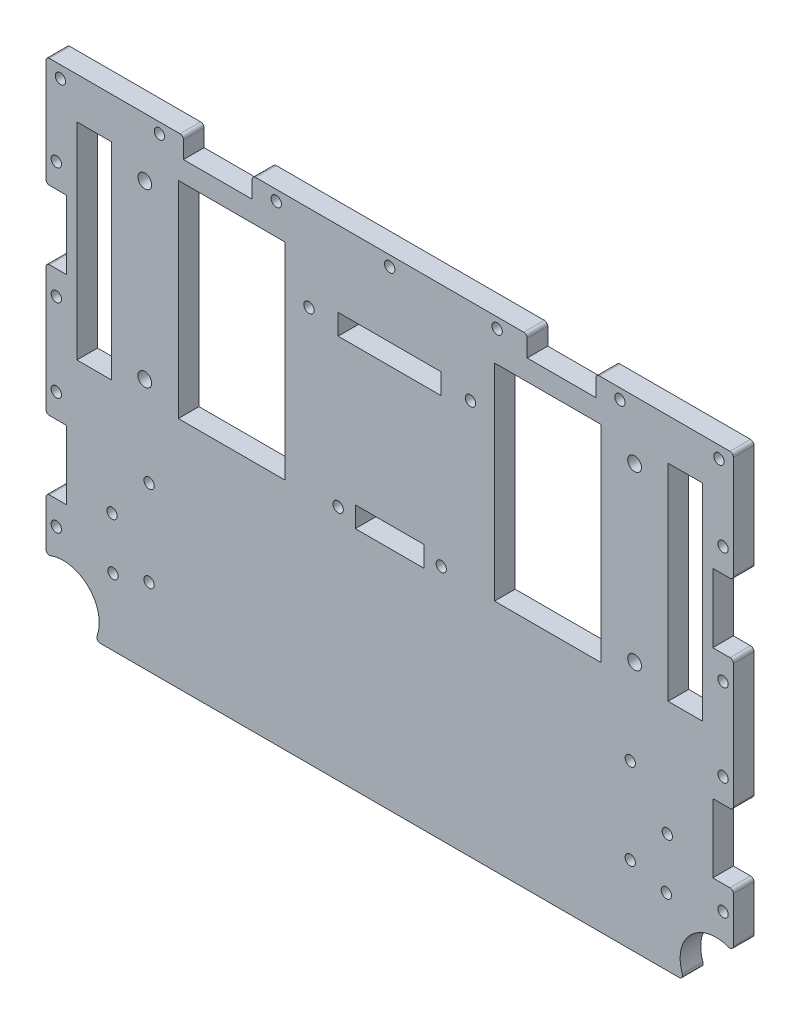
from build123d import *

# Parameters (mm, degrees)
ESQUISSE1_W              = 200
ESQUISSE1_H              = 140
BOSS_EXTRU_1_DEPTH       = 6
ESQUISSE8_W              = 31
ESQUISSE8_H              = 60
ESQUISSE8_W_2            = 10
ENL_V_MAT_EXTRU_2_DEPTH  = 6
ESQUISSE9_W              = 20
ESQUISSE9_H              = 6
ENL_V_MAT_EXTRU_3_DEPTH  = 6
ESQUISSE10_W             = 6
ESQUISSE10_H             = 20
ENL_V_MAT_EXTRU_4_DEPTH  = 6
ESQUISSE14_W             = 30
ESQUISSE14_H             = 6
ENL_V_MAT_EXTRU_7_DEPTH  = 6
ESQUISSE15_R             = 10.5
ENL_V_MAT_EXTRU_8_DEPTH  = 6
ESQUISSE19_R             = 2
ENL_V_MAT_EXTRU_11_DEPTH = 245.204832057
ESQUISSE20_R             = 1.5
ENL_V_MAT_EXTRU_12_DEPTH = 245.204832057
ESQUISSE21_R             = 1.5
ESQUISSE21_W             = 20
ESQUISSE21_H             = 6
ENL_V_MAT_EXTRU_13_DEPTH = 10
ESQUISSE23_R             = 1.5
ENL_V_MAT_EXTRU_15_DEPTH = 6
ESQUISSE16_R             = 1.5
ENL_V_MAT_EXTRU_9_DEPTH  = 6
ESQUISSE28_W             = 6
ESQUISSE28_H             = 20
ENL_V_MAT_EXTRU_17_DEPTH = 245.204832057
ESQUISSE29_R             = 1.5
ENL_V_MAT_EXTRU_18_DEPTH = 245.204832057
ESQUISSE35_R             = 1.5
ENL_V_MAT_EXTRU_21_DEPTH = 6
CONG_1_R                 = 1


with BuildPart() as part:
    # Esquisse1 → Boss.-Extru.1 (new body)
    with BuildSketch(Plane.XY):
        with Locations((100, -70)):
            Rectangle(ESQUISSE1_W, ESQUISSE1_H)
    extrude(amount=BOSS_EXTRU_1_DEPTH)

    # Esquisse8 → Enlèv. mat.-Extru.2 (cut)
    with BuildSketch(Plane(origin=(0, 0, 0), x_dir=(-1, 0, 0), z_dir=(0, 0, -1))):
        with Locations((-146, -42)):
            Rectangle(ESQUISSE8_W, ESQUISSE8_H)
        with Locations((-186, -42)):
            Rectangle(ESQUISSE8_W_2, ESQUISSE8_H)
        with Locations((-14, -42)):
            Rectangle(ESQUISSE8_W_2, ESQUISSE8_H)
        with Locations((-54, -42)):
            Rectangle(ESQUISSE8_W, ESQUISSE8_H)
    extrude(amount=-ENL_V_MAT_EXTRU_2_DEPTH, mode=Mode.SUBTRACT)

    # Esquisse9 → Enlèv. mat.-Extru.3 (cut)
    with BuildSketch(Plane(origin=(0, 0, 0), x_dir=(-1, 0, 0), z_dir=(0, 0, -1))):
        with Locations((-150, -3)):
            Rectangle(ESQUISSE9_W, ESQUISSE9_H)
        with Locations((-50, -3)):
            Rectangle(ESQUISSE9_W, ESQUISSE9_H)
    extrude(amount=-ENL_V_MAT_EXTRU_3_DEPTH, mode=Mode.SUBTRACT)

    # Esquisse10 → Enlèv. mat.-Extru.4 (cut)
    with BuildSketch(Plane(origin=(0, 0, 0), x_dir=(-1, 0, 0), z_dir=(0, 0, -1))):
        with Locations((-197, -100)):
            Rectangle(ESQUISSE10_W, ESQUISSE10_H)
        with Locations((-3, -100)):
            Rectangle(ESQUISSE10_W, ESQUISSE10_H)
    extrude(amount=-ENL_V_MAT_EXTRU_4_DEPTH, mode=Mode.SUBTRACT)

    # Esquisse14 → Enlèv. mat.-Extru.7 (cut)
    with BuildSketch(Plane.XY.offset(6)):
        with Locations((100, -25)):
            Rectangle(ESQUISSE14_W, ESQUISSE14_H)
    extrude(amount=-ENL_V_MAT_EXTRU_7_DEPTH, mode=Mode.SUBTRACT)

    # Esquisse15 → Enlèv. mat.-Extru.8 (cut)
    with BuildSketch(Plane.XY.offset(6)):
        with Locations((195, -135)):
            Circle(ESQUISSE15_R)
        with Locations((5, -135)):
            Circle(ESQUISSE15_R)
    extrude(amount=-ENL_V_MAT_EXTRU_8_DEPTH, mode=Mode.SUBTRACT)

    # Esquisse19 → Enlèv. mat.-Extru.11 (cut, through all)
    with BuildSketch(Plane(origin=(0, 0, 0), x_dir=(-1, 0, 0), z_dir=(0, 0, -1))):
        with Locations((-28.75, -67)):
            Circle(ESQUISSE19_R)
        with Locations((-28.75, -17)):
            Circle(ESQUISSE19_R)
        with Locations(Location((-171.25, -17, 0), (0, 0, 180))):
            Circle(ESQUISSE19_R)
        with Locations(Location((-171.25, -67, 0), (0, 0, 180))):
            Circle(ESQUISSE19_R)
    extrude(amount=-ENL_V_MAT_EXTRU_11_DEPTH, mode=Mode.SUBTRACT)

    # Esquisse20 → Enlèv. mat.-Extru.12 (cut, through all)
    with BuildSketch(Plane.XY.offset(6)):
        with Locations((19.495689014, -120.504310986)):
            Circle(ESQUISSE20_R)
        with Locations((19.212846302, -105.506977889)):
            Circle(ESQUISSE20_R)
        with Locations(Location((180.787153698, -105.506977889, 0), (0, 0, 180))):
            Circle(ESQUISSE20_R)
        with Locations((30, -117.5)):
            Circle(ESQUISSE20_R)
        with Locations((30, -92.5)):
            Circle(ESQUISSE20_R)
        with Locations(Location((180.504310986, -120.504310986, 0), (0, 0, 180))):
            Circle(ESQUISSE20_R)
        with Locations(Location((170, -92.5, 0), (0, 0, 180))):
            Circle(ESQUISSE20_R)
        with Locations(Location((170, -117.5, 0), (0, 0, 180))):
            Circle(ESQUISSE20_R)
        with Locations((76.5, -25)):
            Circle(ESQUISSE20_R)
        with Locations((123.5, -25)):
            Circle(ESQUISSE20_R)
    extrude(amount=-ENL_V_MAT_EXTRU_12_DEPTH, mode=Mode.SUBTRACT)

    # Esquisse21 → Enlèv. mat.-Extru.13 (cut)
    with BuildSketch(Plane(origin=(0, 0, 0), x_dir=(-1, 0, 0), z_dir=(0, 0, -1))):
        with Locations((-85, -71)):
            Circle(ESQUISSE21_R)
        with Locations((-115, -71)):
            Circle(ESQUISSE21_R)
        with Locations((-100, -71)):
            Rectangle(ESQUISSE21_W, ESQUISSE21_H)
    extrude(amount=-ENL_V_MAT_EXTRU_13_DEPTH, mode=Mode.SUBTRACT)

    # Esquisse23 → Enlèv. mat.-Extru.15 (cut)
    with BuildSketch(Plane(origin=(0, 0, 0), x_dir=(-1, 0, 0), z_dir=(0, 0, -1))):
        with Locations(Location((-4.2, -3.5, 0), (0, 0, 180))):
            Circle(ESQUISSE23_R)
        with Locations((-195.8, -3.5)):
            Circle(ESQUISSE23_R)
    extrude(amount=-ENL_V_MAT_EXTRU_15_DEPTH, mode=Mode.SUBTRACT)

    # Esquisse16 → Enlèv. mat.-Extru.9 (cut)
    with BuildSketch(Plane(origin=(0, 0, 0), x_dir=(-1, 0, 0), z_dir=(0, 0, -1))):
        with Locations((-3, -83)):
            Circle(ESQUISSE16_R)
        with Locations(Location((-197, -117, 0), (0, 0, 180))):
            Circle(ESQUISSE16_R)
        with Locations((-197, -83)):
            Circle(ESQUISSE16_R)
        with Locations((-3, -117)):
            Circle(ESQUISSE16_R)
    extrude(amount=-ENL_V_MAT_EXTRU_9_DEPTH, mode=Mode.SUBTRACT)

    # Esquisse28 → Enlèv. mat.-Extru.17 (cut, through all)
    with BuildSketch(Plane.XY.offset(6)):
        with Locations((3, -42)):
            Rectangle(ESQUISSE28_W, ESQUISSE28_H)
        with Locations((197, -42)):
            Rectangle(ESQUISSE28_W, ESQUISSE28_H)
    extrude(amount=-ENL_V_MAT_EXTRU_17_DEPTH, mode=Mode.SUBTRACT)

    # Esquisse29 → Enlèv. mat.-Extru.18 (cut, through all)
    with BuildSketch(Plane(origin=(0, 0, 0), x_dir=(-1, 0, 0), z_dir=(0, 0, -1))):
        with Locations((-197, -25)):
            Circle(ESQUISSE29_R)
        with Locations((-197, -59)):
            Circle(ESQUISSE29_R)
        with Locations(Location((-3, -59, 0), (0, 0, 180))):
            Circle(ESQUISSE29_R)
        with Locations(Location((-3, -25, 0), (0, 0, 180))):
            Circle(ESQUISSE29_R)
    extrude(amount=-ENL_V_MAT_EXTRU_18_DEPTH, mode=Mode.SUBTRACT)

    # Esquisse35 → Enlèv. mat.-Extru.21 (cut)
    with BuildSketch(Plane(origin=(0, 0, 0), x_dir=(-1, 0, 0), z_dir=(0, 0, -1))):
        with Locations((-167, -3)):
            Circle(ESQUISSE35_R)
        with Locations((-131.260401336, -3)):
            Circle(ESQUISSE35_R)
        with Locations((-100, -3)):
            Circle(ESQUISSE35_R)
        with Locations((-67, -3)):
            Circle(ESQUISSE35_R)
        with Locations((-33, -3)):
            Circle(ESQUISSE35_R)
    extrude(amount=-ENL_V_MAT_EXTRU_21_DEPTH, mode=Mode.SUBTRACT)

    # Congé1
    cong_1_edges = [part.edges().sort_by_distance(p)[0] for p in [
        (200, -110, 3),
        (200, -90, 3),
        (0, -90, 3),
        (0, -110, 3),
        (185.766907344, -140, 3),
        (200, -125.766907344, 3),
        (14.233092656, -140, 3),
        (0, -125.766907344, 3),
        (0, -52, 3),
        (0, -32, 3),
        (200, -32, 3),
        (200, -52, 3),
        (0, 0, 3),
        (200, 0, 3),
        (160, 0, 3),
        (140, 0, 3),
        (60, 0, 3),
        (40, 0, 3),
    ]]
    fillet(cong_1_edges, radius=CONG_1_R)


solid = part.part
